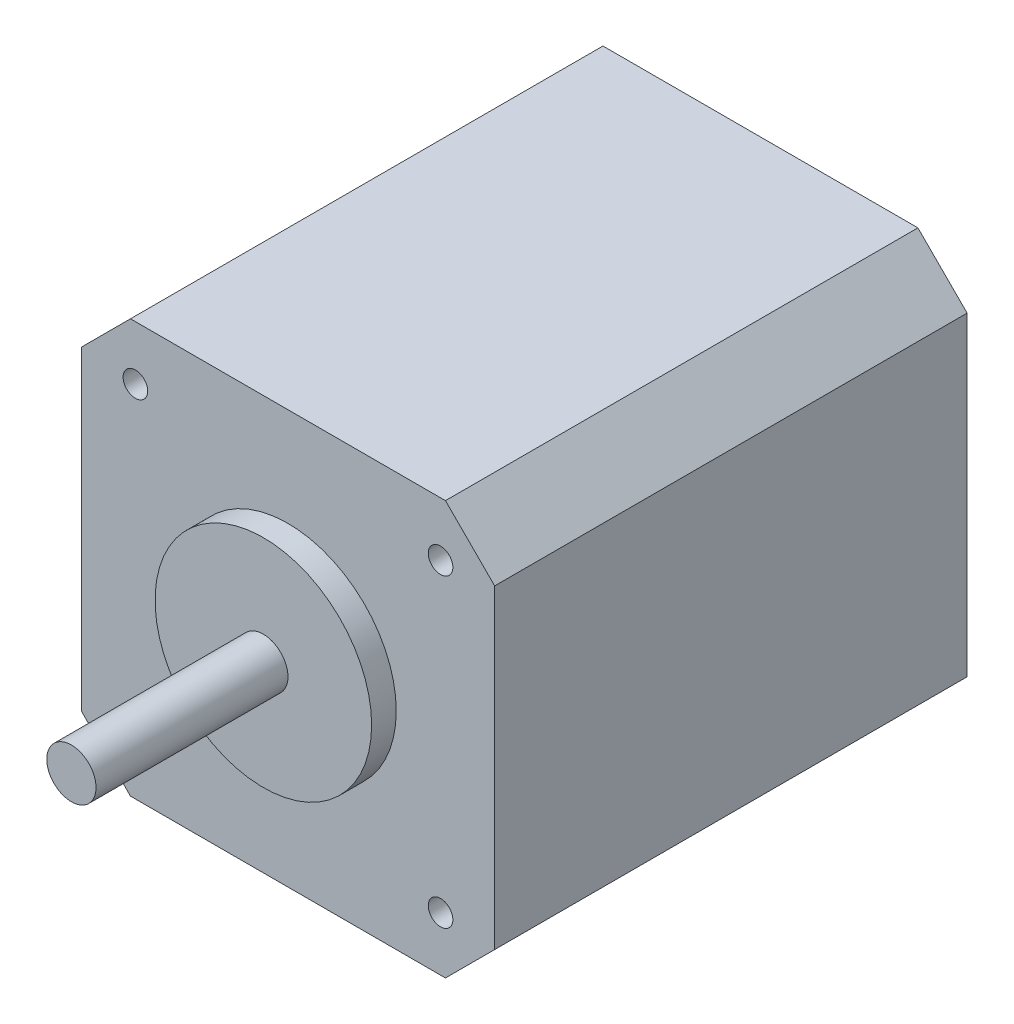
from build123d import *

# Parameters (mm, degrees)
EXTRUDE_1_DEPTH        = 24
SKETCH_2_R             = 11
SKETCH_2_R_2           = 2.5
EXTRUDE_2_DEPTH        = 2.5
SKETCH_2_2_R           = 2.5
EXTRUDE_3_DEPTH        = 22
HOLE_WIZARD_M3_1_D     = 2.5
HOLE_WIZARD_M3_1_DEPTH = 7.5
HOLE_WIZARD_M3_1_TIP   = 0.751075774


with BuildPart() as part:
    # 草图1 → 凸台-拉伸1 (new, symmetric)
    with BuildSketch(Plane.XY):
        Polygon((-21, 16), (-16, 21), (16, 21), (21, 16), (21, -16), (16, -21), (-16, -21), (-21, -16), align=None)
    extrude(amount=EXTRUDE_1_DEPTH, both=True)

    # 草图2 → 凸台-拉伸2 (add)
    with BuildSketch(Plane.XY.offset(24)):
        Circle(SKETCH_2_R)
        Circle(SKETCH_2_R_2, mode=Mode.SUBTRACT)
    extrude(amount=EXTRUDE_2_DEPTH)

    # 草图2<2> → 凸台-拉伸3 (add)
    with BuildSketch(Plane.XY.offset(24)):
        Circle(SKETCH_2_2_R)
    extrude(amount=EXTRUDE_3_DEPTH)

    # M3 螺纹孔1
    with Locations(Plane.XY.offset(24)):
        with Locations((-15.5, 15.5), (15.5, 15.5), (15.5, -15.5), (-15.5, -15.5)):
            Hole(HOLE_WIZARD_M3_1_D / 2, depth=HOLE_WIZARD_M3_1_DEPTH)
            with Locations((0, 0, -(HOLE_WIZARD_M3_1_DEPTH + HOLE_WIZARD_M3_1_TIP / 2))):  # 118° drill point
                Cone(0, HOLE_WIZARD_M3_1_D / 2, HOLE_WIZARD_M3_1_TIP, mode=Mode.SUBTRACT)


solid = part.part
